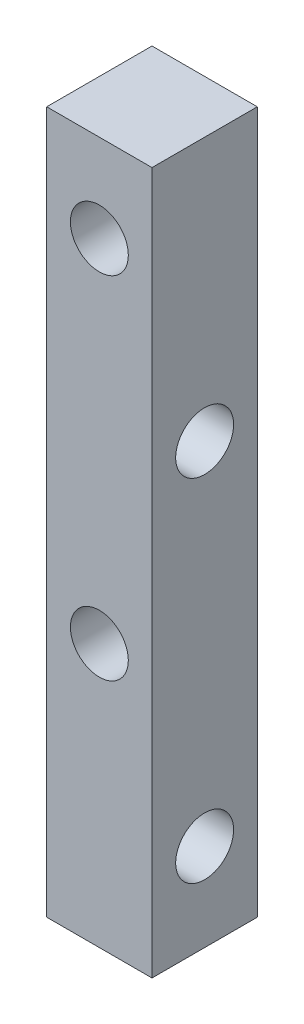
from build123d import *

# Parameters (mm, degrees)
SKETCH_1_W               = 6
SKETCH_1_H               = 6
EXTRUDE_1_DEPTH          = 20
CUT_EXTRUDE_1_DEPTH      = 22.09502311
CUT_EXTRUDE_1_DEPTH_BACK = 22.09502311
SKETCH_3_R               = 1.65
CUT_EXTRUDE_2_DEPTH      = 22.09502311
CUT_EXTRUDE_2_DEPTH_BACK = 22.09502311
SKETCH_4_R               = 1.65


with BuildPart() as part:
    # 草图1 → 凸台-拉伸1 (new, symmetric)
    with BuildSketch(Plane(origin=(0, 0, 0), x_dir=(1, 0, 0), z_dir=(0, 1, 0))):
        Rectangle(SKETCH_1_W, SKETCH_1_H)
    extrude(amount=EXTRUDE_1_DEPTH, both=True)

    # 草图3 → 切除-拉伸1 (cut, two sides: drawn at the far end of the back side and taken through both)
    with BuildSketch(Plane.XY.offset(3).offset(-CUT_EXTRUDE_1_DEPTH_BACK)):
        with Locations((0, 15)):
            Circle(SKETCH_3_R)
        with Locations((0, -5)):
            Circle(SKETCH_3_R)
    extrude(amount=CUT_EXTRUDE_1_DEPTH + CUT_EXTRUDE_1_DEPTH_BACK, mode=Mode.SUBTRACT)

    # 草图4 → 切除-拉伸2 (cut, two sides: drawn at the far end of the back side and taken through both)
    with BuildSketch(Plane(origin=(3, 0, 0), x_dir=(0, 0, -1), z_dir=(1, 0, 0)).offset(-CUT_EXTRUDE_2_DEPTH_BACK)):
        with Locations((0, 5)):
            Circle(SKETCH_4_R)
        with Locations((0, -15)):
            Circle(SKETCH_4_R)
    extrude(amount=CUT_EXTRUDE_2_DEPTH + CUT_EXTRUDE_2_DEPTH_BACK, mode=Mode.SUBTRACT)


solid = part.part
